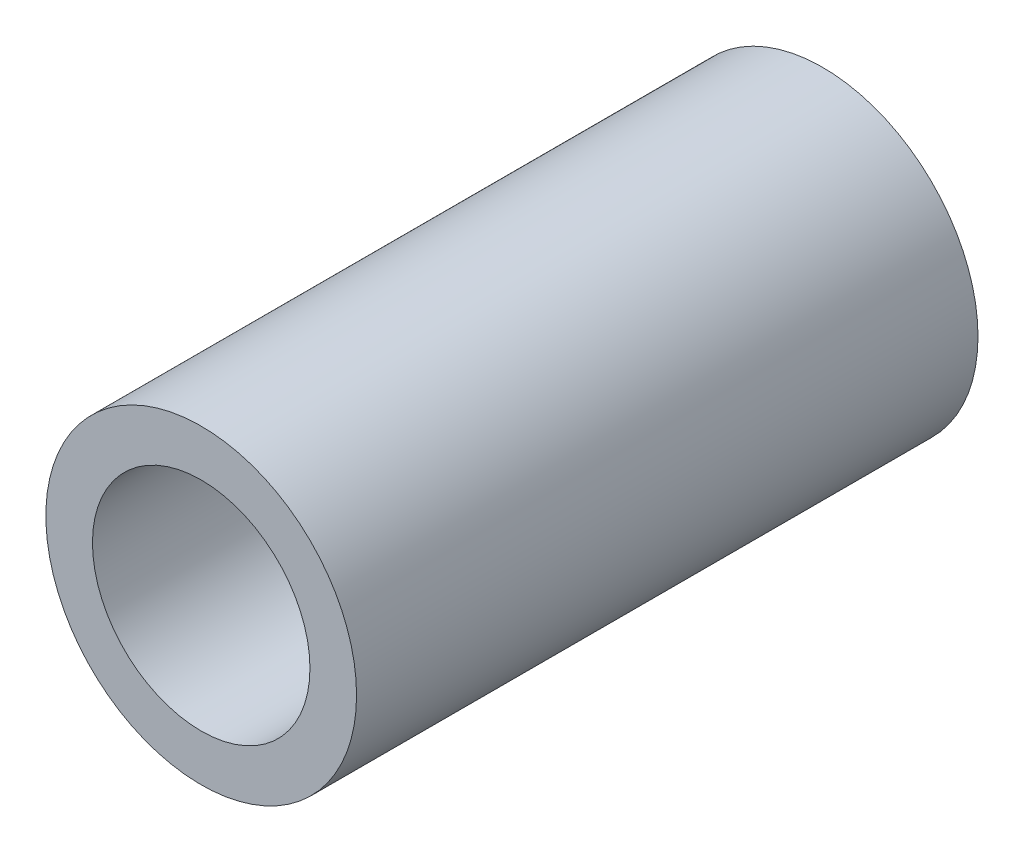
from build123d import *

# Parameters (mm, degrees)
SKETCH_1_R      = 2
SKETCH_1_R_2    = 1.4
EXTRUDE_1_DEPTH = 8


with BuildPart() as part:
    # 草图1 → 凸台-拉伸1 (new body)
    with BuildSketch(Plane.XY):
        Circle(SKETCH_1_R)
        Circle(SKETCH_1_R_2, mode=Mode.SUBTRACT)
    extrude(amount=EXTRUDE_1_DEPTH)


solid = part.part
